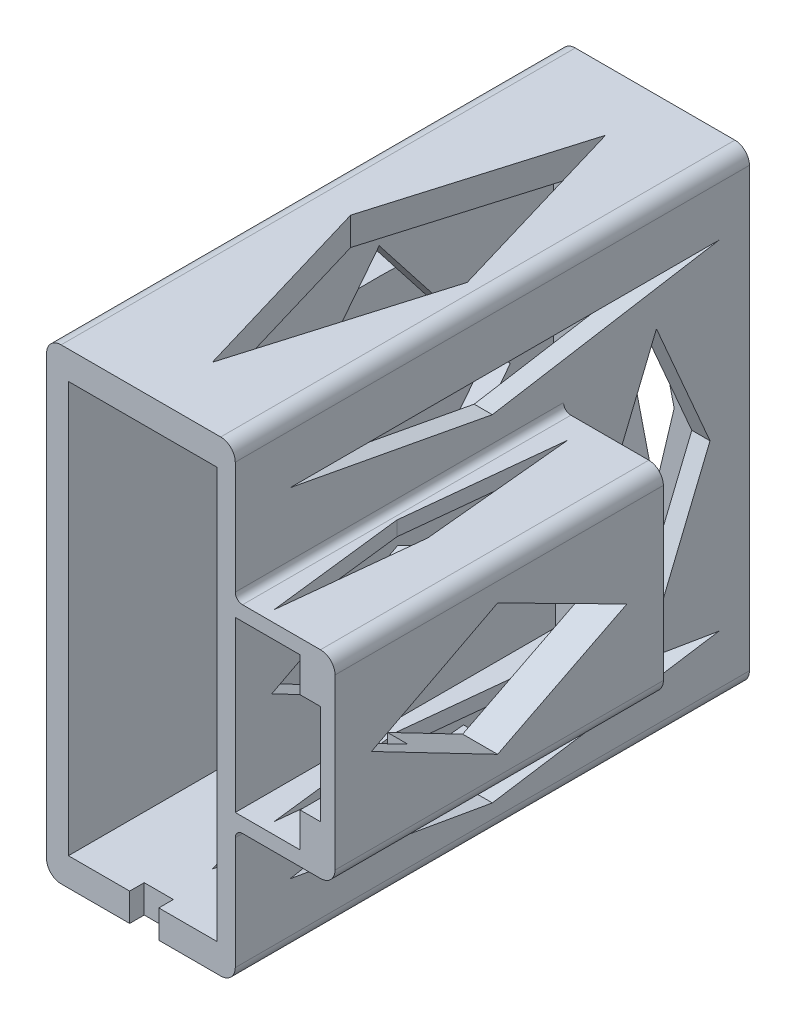
from build123d import *

# Parameters (mm, degrees)
SKETCH2_W                 = 64.1
SKETCH2_H                 = 70.6
BOSS_EXTRUDE1_DEPTH       = 22.91
SKETCH4_W                 = 21.2
SKETCH4_H                 = 56.4
CUT_EXTRUDE2_DEPTH        = 66.6
SKETCH5_W                 = 27.2
SKETCH5_H                 = 37
BOSS_EXTRUDE2_DEPTH       = 11.7
SKETCH7_W                 = 11.7
SKETCH7_H                 = 27.2
BOSS_EXTRUDE3_DEPTH       = 8.08
SKETCH6_W                 = 8.9
SKETCH6_H                 = 23.2
CUT_EXTRUDE3_DEPTH        = 44
SKETCH8_W                 = 12.2
SKETCH8_H                 = 13.7
CUT_EXTRUDE4_DEPTH        = 12
CUT_EXTRUDE5_REACH        = 64.088
SKETCH10_W                = 27.2
SKETCH10_H                = 45.08
BOSS_EXTRUDE4_DEPTH       = 2
SKETCH11_W                = 5
SKETCH11_H                = 11
CUT_EXTRUDE6_DEPTH        = 2
BOSS_EXTRUDE5_DEPTH       = 27.2
CUT_EXTRUDE8_REACH        = 84.64
SKETCH14_W                = 14.896508991
SKETCH14_H                = 5
SKETCH15_R                = 3.5
CUT_EXTRUDE9_DEPTH        = 5
THREAD2_PITCH             = 1.5
THREAD2_HEIGHT            = 10
THREAD2_RADIUS            = 3.5
THREAD2_START_ANGLE       = -180
CUT_EXTRUDE13_REACH       = 80.566
CUT_EXTRUDE14_REACH       = 62.113
SKETCH41_W                = 7
SKETCH41_H                = 12.238058432
CUT_EXTRUDE15_DEPTH       = 1.08
CUT_EXTRUDE16_DEPTH       = 4
SKETCH44_W                = 4
SKETCH44_H                = 3.85
CUT_EXTRUDE17_DEPTH       = 2
FILLET1_R                 = 2
SKETCH45_W                = 37.09673571
SKETCH45_H                = 46.917342367
CUT_EXTRUDE18_DEPTH       = 17.2
SKETCH46_W                = 64.1
SKETCH46_H                = 70.6
BOSS_EXTRUDE6_DEPTH       = 5
SKETCH48_W                = 70.6
SKETCH48_H                = 64.1
BOSS_EXTRUDE7_DEPTH       = 5
CUT_EXTRUDE19_DEPTH       = 3.5
CUT_EXTRUDE19_DEPTH_BACK  = 4
CHAMFER1_SIZE             = 0.2
SKETCH53_W                = 8.871125199
SKETCH53_H                = 9.434371244
BOSS_EXTRUDE8_DEPTH       = 10
SKETCH54_W                = 7
SKETCH54_H                = 64.1
CUT_EXTRUDE20_DEPTH       = 70.6
FILLET2_R                 = 2
FILLET3_R                 = 1
BOSS_EXTRUDE10_DEPTH      = 15
BOSS_EXTRUDE10_DEPTH_BACK = 15
CUT_EXTRUDE21_DEPTH       = 30
CUT_EXTRUDE22_DEPTH       = 3
CUT_EXTRUDE23_DEPTH       = 2.5
CUT_EXTRUDE24_DEPTH       = 2.5
CUT_EXTRUDE25_DEPTH       = 30


with BuildPart() as part:
    # Sketch2 → Boss-Extrude1 (new body)
    with BuildSketch(Plane.YZ):
        Rectangle(SKETCH2_W, SKETCH2_H)
    extrude(amount=-BOSS_EXTRUDE1_DEPTH)

    # Sketch4 → Cut-Extrude2 (cut)
    with BuildSketch(Plane.XY.offset(35.3)):
        with Locations((-13.1, 0)):
            Rectangle(SKETCH4_W, SKETCH4_H)
    extrude(amount=-CUT_EXTRUDE2_DEPTH, mode=Mode.SUBTRACT)

    # Sketch5 → Boss-Extrude2 (add)
    with BuildSketch(Plane.YZ):
        with Locations((0, 16.8)):
            Rectangle(SKETCH5_W, SKETCH5_H)
    extrude(amount=BOSS_EXTRUDE2_DEPTH)

    # Sketch7 → Boss-Extrude3 (add)
    with BuildSketch(Plane(origin=(0, 0, -1.7), x_dir=(1, 0, 0), z_dir=(0, 0, -1))):
        with Locations((5.85, 0)):
            Rectangle(SKETCH7_W, SKETCH7_H)
    extrude(amount=BOSS_EXTRUDE3_DEPTH)

    # Sketch6 → Cut-Extrude3 (cut)
    with BuildSketch(Plane.XY.offset(35.3)):
        with Locations((4.45, 0)):
            Rectangle(SKETCH6_W, SKETCH6_H)
    extrude(amount=-CUT_EXTRUDE3_DEPTH, mode=Mode.SUBTRACT)

    # Sketch8 → Cut-Extrude4 (cut)
    with BuildSketch(Plane.XY.offset(35.3)):
        with Locations((6.1, 0)):
            Rectangle(SKETCH8_W, SKETCH8_H)
    extrude(amount=-CUT_EXTRUDE4_DEPTH, mode=Mode.SUBTRACT)

    # Cut-Extrude5: up to this face of the body (flat: up to its plane)
    cut_extrude5_end = Plane(part.part.faces().sort_by_distance((5.85, -13.6, 12.76))[0])
    # Sketch9 → Cut-Extrude5 (cut, up to the picked face)
    with BuildSketch(Plane(origin=(0, 13.6, 0), x_dir=(-1, 0, 0), z_dir=(0, 1, 0)), mode=Mode.PRIVATE) as cut_extrude5_sk1:
        Polygon((-3.758381781, 33.720026795), (-5.773286722, 14.637691772), (-3.758381781, -6.578072011), (-1.518207966, 14.637691772), align=None)
    cut_extrude5_tool1 = split(extrude(cut_extrude5_sk1.sketch, amount=-CUT_EXTRUDE5_REACH, mode=Mode.PRIVATE), bisect_by=cut_extrude5_end, keep=Keep.BOTH, mode=Mode.PRIVATE)
    add(cut_extrude5_tool1.solids().sort_by(Axis((3.683292, 13.6, 13.926549), (0, -1, 0)))[0], mode=Mode.SUBTRACT)

    # Sketch10 → Boss-Extrude4 (add)
    with BuildSketch(Plane.YZ.offset(11.7)):
        with Locations((0, 12.76)):
            Rectangle(SKETCH10_W, SKETCH10_H)
    extrude(amount=BOSS_EXTRUDE4_DEPTH)

    # Sketch11 → Cut-Extrude6 (cut)
    with BuildSketch(Plane.XZ.offset(13.6)):
        with Locations((5.5, 3.72)):
            Rectangle(SKETCH11_W, SKETCH11_H)
    extrude(amount=-CUT_EXTRUDE6_DEPTH, mode=Mode.SUBTRACT)

    # Sketch12 → Boss-Extrude5 (add)
    with BuildSketch(Plane.XZ.offset(13.6)):
        Polygon((13.7, 35.3), (28.596508991, 35.3), (28.596508991, -0.612717465), (23.596508991, -0.612717465), (23.596508991, 26.766284959), (17.316508991, 26.766284959), (13.7, 26.766284959), align=None)
    extrude(amount=-BOSS_EXTRUDE5_DEPTH)

    # Cut-Extrude8: up to this face of the body (flat: up to its plane)
    cut_extrude8_end = Plane(part.part.faces().sort_by_distance((26.096508991, 0, -0.612717465))[0])
    # Sketch14 → Cut-Extrude8 (cut, up to the picked face)
    with BuildSketch(Plane.XY.offset(35.3), mode=Mode.PRIVATE) as cut_extrude8_sk1:
        with Locations((21.148254496, -11.1)):
            Rectangle(SKETCH14_W, SKETCH14_H)
    cut_extrude8_tool1 = split(extrude(cut_extrude8_sk1.sketch, amount=-CUT_EXTRUDE8_REACH, mode=Mode.PRIVATE), bisect_by=cut_extrude8_end, keep=Keep.BOTH, mode=Mode.PRIVATE)
    # Sketch14 → Cut-Extrude8 (cut, up to the picked face)
    with BuildSketch(Plane.XY.offset(35.3), mode=Mode.PRIVATE) as cut_extrude8_sk2:
        with Locations((21.148254496, 11.1)):
            Rectangle(SKETCH14_W, SKETCH14_H)
    cut_extrude8_tool2 = split(extrude(cut_extrude8_sk2.sketch, amount=-CUT_EXTRUDE8_REACH, mode=Mode.PRIVATE), bisect_by=cut_extrude8_end, keep=Keep.BOTH, mode=Mode.PRIVATE)
    add(cut_extrude8_tool1.solids().sort_by(Axis((21.148254, -11.1, 35.3), (0, 0, -1)))[0], mode=Mode.SUBTRACT)
    add(cut_extrude8_tool2.solids().sort_by(Axis((21.148254, 11.1, 35.3), (0, 0, -1)))[0], mode=Mode.SUBTRACT)

    # Sketch15 → Cut-Extrude9 (cut)
    with BuildSketch(Plane.YZ.offset(28.596508991)):
        with Locations(Location((0, 18.430454013, 0), (0, 0, 270))):
            Circle(SKETCH15_R)
    extrude(amount=-CUT_EXTRUDE9_DEPTH, mode=Mode.SUBTRACT)

    # Thread2: sweep along a helix
    with BuildLine() as thread2_path:
        add(Helix(THREAD2_PITCH, THREAD2_HEIGHT, THREAD2_RADIUS, center=(29.596508991, 0, 18.430454013), direction=(-1, 0, 0), lefthand=True, mode=Mode.PRIVATE).rotate(Axis((29.596508991, 0, 18.430454013), (-1, 0, 0)), THREAD2_START_ANGLE))
    # Thread Profile3 → Thread2 (sweep, cut)
    with BuildSketch(Plane(origin=(29.596508991, 0, 21.930454013), x_dir=(0, 0, 1), z_dir=(0, -1, 0))):
        Polygon((0, 0), (0.811898813, 0.468749998), (0.811898813, 0.656249998), (0, 1.124999996), align=None)
    sweep(path=thread2_path.line, is_frenet=True, mode=Mode.SUBTRACT)

    # Cut-Extrude13: up to this face of the body (flat: up to its plane)
    cut_extrude13_end = Plane(part.part.faces().sort_by_distance((-11.455, 32.05, 0))[0])
    # Sketch39 → Cut-Extrude13 (cut, up to the picked face)
    with BuildSketch(Plane.XZ.offset(32.05), mode=Mode.PRIVATE) as cut_extrude13_sk1:
        Polygon((-11.455, 27), (-19.455, 0), (-11.455, -27), (-3.455, 0), align=None)
    cut_extrude13_tool1 = split(extrude(cut_extrude13_sk1.sketch, amount=-CUT_EXTRUDE13_REACH, mode=Mode.PRIVATE), bisect_by=cut_extrude13_end, keep=Keep.BOTH, mode=Mode.PRIVATE)
    add(cut_extrude13_tool1.solids().sort_by(Axis((-11.455, -32.05, 0), (0, 1, 0)))[0], mode=Mode.SUBTRACT)

    # Cut-Extrude14: up to this face of the body (flat: up to its plane)
    cut_extrude14_end = Plane(part.part.faces().sort_by_distance((8.9, 0, 10.228538066))[0])
    # Sketch40 → Cut-Extrude14 (cut, up to the picked face)
    with BuildSketch(Plane.YZ.offset(13.7), mode=Mode.PRIVATE) as cut_extrude14_sk1:
        Polygon((0, -4.78), (9, 12.976283311), (0, 30.3), (-9, 12.976283311), align=None)
    cut_extrude14_tool1 = split(extrude(cut_extrude14_sk1.sketch, amount=-CUT_EXTRUDE14_REACH, mode=Mode.PRIVATE), bisect_by=cut_extrude14_end, keep=Keep.BOTH, mode=Mode.PRIVATE)
    add(cut_extrude14_tool1.solids().sort_by(Axis((13.7, 0, 12.832094), (-1, 0, 0)))[0], mode=Mode.SUBTRACT)

    # Sketch41 → Cut-Extrude15 (cut)
    with BuildSketch(Plane(origin=(0, 0, -9.78), x_dir=(1, 0, 0), z_dir=(0, 0, -1))):
        with Locations((3.5, 0)):
            Rectangle(SKETCH41_W, SKETCH41_H)
    extrude(amount=-CUT_EXTRUDE15_DEPTH, mode=Mode.SUBTRACT)

    # Sketch42 → Cut-Extrude16 (cut)
    with BuildSketch(Plane(origin=(0, 0, -35.3), x_dir=(1, 0, 0), z_dir=(0, 0, -1))):
        Polygon((-11.455, 21.539378486), (-16.575689674, 0), (-11.455, -21.539378486), (-6.334310326, 0), align=None)
    extrude(amount=-CUT_EXTRUDE16_DEPTH, mode=Mode.SUBTRACT)

    # Sketch44 → Cut-Extrude17 (cut)
    with BuildSketch(Plane.XY.offset(35.3)):
        with Locations((-12.5, -30.125)):
            Rectangle(SKETCH44_W, SKETCH44_H)
    extrude(amount=-CUT_EXTRUDE17_DEPTH, mode=Mode.SUBTRACT)

    # Fillet1
    fillet1_edges = [part.edges().sort_by_distance(p)[0] for p in [
        (13.7, 13.6, 12.76),
        (13.7, -13.6, 12.76),
        (0, -32.05, 0),
        (0, 32.05, 0),
    ]]
    fillet(fillet1_edges, radius=FILLET1_R)

    # Sketch45 → Cut-Extrude18 (cut)
    with BuildSketch(Plane.XZ.offset(8.6)):
        with Locations((32.248367855, 11.841328817)):
            Rectangle(SKETCH45_W, SKETCH45_H)
    extrude(amount=-CUT_EXTRUDE18_DEPTH, mode=Mode.SUBTRACT)

    # Sketch46 → Boss-Extrude6 (add)
    with BuildSketch(Plane(origin=(-22.91, 0, 0), x_dir=(0, -1, 0), z_dir=(-1, 0, 0))):
        Rectangle(SKETCH46_W, SKETCH46_H)
    extrude(amount=BOSS_EXTRUDE6_DEPTH)

    # Sketch48 → Boss-Extrude7 (add)
    with BuildSketch(Plane.ZY.offset(27.91)):
        Rectangle(SKETCH48_W, SKETCH48_H)
    extrude(amount=BOSS_EXTRUDE7_DEPTH)

    # Sketch52 → Cut-Extrude19 (cut, two sides: drawn at the far end of the back side and taken through both)
    with BuildSketch(Plane.XY.offset(25.3).offset(-CUT_EXTRUDE19_DEPTH_BACK)):
        with BuildLine():
            Line((-32.91, -2.5), (-32.41, -2.5))
            ThreePointArc((-32.41, -2.5), (-29.904288208, -3.5), (-27.431598813, -2.420926907))
            ThreePointArc((-27.431598813, -2.420926907), (-26.459438058, 0), (-27.431598813, 2.420926907))
            ThreePointArc((-27.431598813, 2.420926907), (-29.904288208, 3.5), (-32.41, 2.5))
            Line((-32.41, 2.5), (-32.91, 2.5))
            Line((-32.91, 2.5), (-32.91, -2.5))
        make_face()
    extrude(amount=CUT_EXTRUDE19_DEPTH + CUT_EXTRUDE19_DEPTH_BACK, mode=Mode.SUBTRACT)

    # Chamfer1
    chamfer1_edges = [part.edges().sort_by_distance(p)[0] for p in [
        (-32.91, 2.5, 25.05),
        (-32.91, -2.5, 25.05),
    ]]
    chamfer(chamfer1_edges, length=CHAMFER1_SIZE)

    # Sketch53 → Boss-Extrude8 (add)
    with BuildSketch(Plane(origin=(-32.91, 0, 0), x_dir=(0, -1, 0), z_dir=(-1, 0, 0))):
        with Locations((0.211217266, 24.67721732)):
            Rectangle(SKETCH53_W, SKETCH53_H)
    extrude(amount=-BOSS_EXTRUDE8_DEPTH)

    # Sketch54 → Cut-Extrude20 (cut)
    with BuildSketch(Plane.XY.offset(35.3)):
        with Locations((-29.41, 0)):
            Rectangle(SKETCH54_W, SKETCH54_H)
    extrude(amount=-CUT_EXTRUDE20_DEPTH, mode=Mode.SUBTRACT)

    # Fillet2
    fillet2_edges = [part.edges().sort_by_distance(p)[0] for p in [
        (-25.91, -32.05, 0),
        (-25.91, 32.05, 0),
    ]]
    fillet(fillet2_edges, radius=FILLET2_R)

    # Fillet3
    fillet3_edges = [part.edges().sort_by_distance(p)[0] for p in [
        (0, -13.6, 12.76),
        (0, 13.6, 12.76),
    ]]
    fillet(fillet3_edges, radius=FILLET3_R)

    # Sketch58 → Cut-Extrude22 (cut)
    with BuildSketch(Plane(origin=(-25.91, 0, 0), x_dir=(0, -1, 0), z_dir=(-1, 0, 0))):
        Polygon((0, 10.623546293), (-23, -7.376453707), (0, -25.376453707), (23, -7.376453707), align=None)
    extrude(amount=-CUT_EXTRUDE22_DEPTH, mode=Mode.SUBTRACT)

    # Sketch59 → Cut-Extrude23 (cut)
    with BuildSketch(Plane.YZ):
        Polygon((0, 30.3), (-9, 12.976283311), (0, -4.78), (9, 12.976283311), align=None)
    extrude(amount=-CUT_EXTRUDE23_DEPTH, mode=Mode.SUBTRACT)

    # Sketch60 → Cut-Extrude24 (cut)
    with BuildSketch(Plane.YZ):
        Polygon((23.25, 27.778073653), (18.050221383, 0), (23.25, -31.131856824), (23.25, 0), align=None)
        Polygon((-23.25, -31.131856824), (-28.113974033, 0), (-23.25, 27.778073653), (-18.050221383, 0), align=None)
        Polygon((0, -15.529474247), (-17, -22.887792456), (0, -29.887792456), (17, -22.529474247), align=None)
    extrude(amount=-CUT_EXTRUDE24_DEPTH, mode=Mode.SUBTRACT)


with BuildPart() as body_2:
    # Sketch55 → Boss-Extrude10 (new, two sides: drawn at the far end of the back side and taken through both)
    with BuildSketch(Plane(origin=(0, 0, 0), x_dir=(-1, 0, 0), z_dir=(0, -1, 0)).offset(-BOSS_EXTRUDE10_DEPTH_BACK)):
        with BuildLine():
            Line((25.91, -31.208220078), (29.523727835, -31.208220078))
            ThreePointArc((29.523727835, -31.208220078), (30.62755681, 0.297981597), (29.523727835, 31.804183271))
            Line((29.523727835, 31.804183271), (25.91, 31.804183271))
            ThreePointArc((25.91, 31.804183271), (27.252769522, 10.297981597), (25.91, -11.208220078))
            Line((25.91, -11.208220078), (25.91, -31.208220078))
        make_face()
    extrude(amount=BOSS_EXTRUDE10_DEPTH + BOSS_EXTRUDE10_DEPTH_BACK)

    # Sketch56 → Cut-Extrude21 (cut)
    with BuildSketch(Plane.XZ.offset(15)):
        with BuildLine():
            Line((-25.91, 14.508220078), (-25.91, 11.208220078))
            Line((-25.91, 11.208220078), (-26.310184517, 7.731173579))
            ThreePointArc((-26.310184517, 7.731173579), (-28.288197672, 11.248313928), (-25.91, 14.508220078))
        make_face()
    extrude(amount=-CUT_EXTRUDE21_DEPTH, mode=Mode.SUBTRACT)

    # Sketch61 → Cut-Extrude25 (cut)
    with BuildSketch(Plane.XZ.offset(15)):
        Polygon((-26.481028174, -31.804183271), (-26.481028174, -26.615666757), (-25.91, -27.108643608), (-25.91, -34.058493615), align=None)
    extrude(amount=-CUT_EXTRUDE25_DEPTH, mode=Mode.SUBTRACT)


solid = Compound([part.part, body_2.part])
